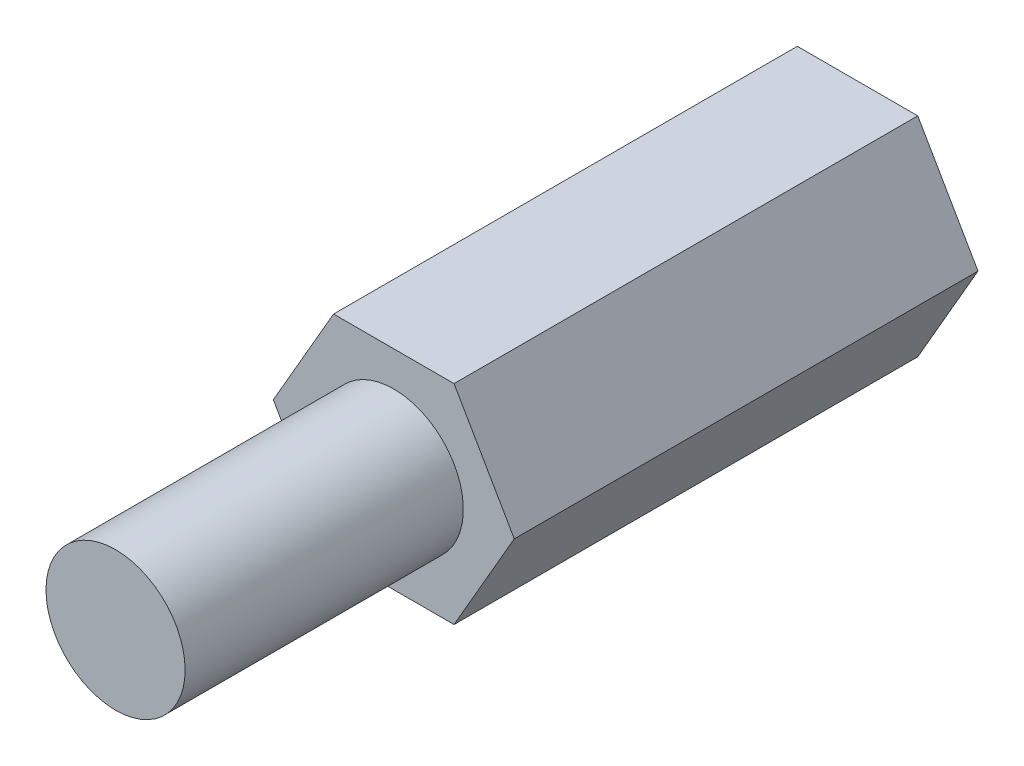
from build123d import *

# Parameters (mm, degrees)
SKETCH1_R           = 1.5
BOSS_EXTRUDE1_DEPTH = 6
BOSS_EXTRUDE2_DEPTH = 10
SKETCH3_R           = 1.5
CUT_EXTRUDE1_DEPTH  = 6


with BuildPart() as part:
    # Sketch1 → Boss-Extrude1 (new body)
    with BuildSketch(Plane.XY):
        Circle(SKETCH1_R)
    extrude(amount=BOSS_EXTRUDE1_DEPTH)

    # Sketch2 → Boss-Extrude2 (add)
    with BuildSketch(Plane(origin=(0, 0, 0), x_dir=(-1, 0, 0), z_dir=(0, 0, -1))):
        Polygon((1.299038106, 2.25), (-1.299038106, 2.25), (-2.598076211, 0), (-1.299038106, -2.25), (1.299038106, -2.25), (2.598076211, 0), align=None)
    extrude(amount=BOSS_EXTRUDE2_DEPTH)

    # Sketch3 → Cut-Extrude1 (cut)
    with BuildSketch(Plane(origin=(0, 0, -10), x_dir=(-1, 0, 0), z_dir=(0, 0, -1))):
        Circle(SKETCH3_R)
    extrude(amount=-CUT_EXTRUDE1_DEPTH, mode=Mode.SUBTRACT)


solid = part.part
